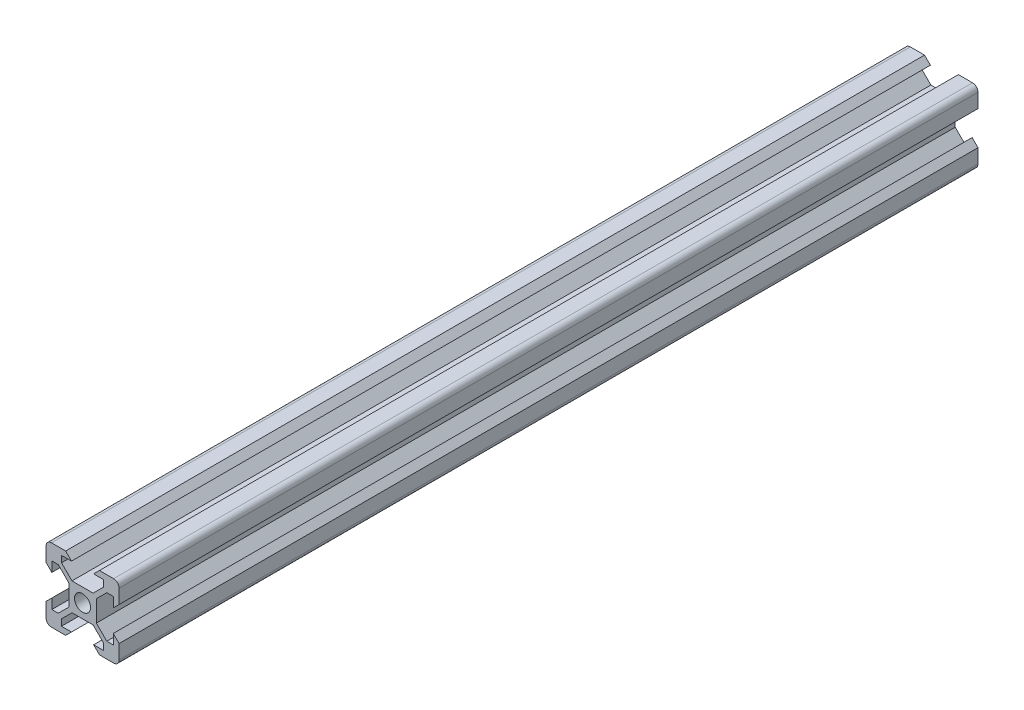
from build123d import *

# Parameters (mm, degrees)
SKETCH1_W           = 15.088
SKETCH1_H           = 15.088
SKETCH1_R           = 4.4
BOSS_EXTRUDE1_DEPTH = 235


with BuildPart() as part:
    # Sketch1 → Boss-Extrude1 (new, symmetric)
    # profile 1 of 5: a face of its own
    with BuildSketch(Plane.XY):
        with BuildLine():
            Line((-7.544, 7.544), (-5.784718328, 7.544))
            Line((-5.784718328, 7.544), (-11.512, 13.271281672))
            Line((-11.512, 13.271281672), (-11.512, 16.8))
            Line((-11.512, 16.8), (-6.051976926, 16.8))
            Line((-6.051976926, 16.8), (-9.251976926, 20))
            Line((-9.251976926, 20), (-17, 20))
            ThreePointArc((-17, 20), (-19.121320344, 19.121320344), (-20, 17))
            Line((-20, 17), (-20, 9.251976926))
            Line((-20, 9.251976926), (-16.8, 6.051976926))
            Line((-16.8, 6.051976926), (-16.8, 11.512))
            Line((-16.8, 11.512), (-13.271281672, 11.512))
            Line((-13.271281672, 11.512), (-7.544, 5.784718328))
            Line((-7.544, 5.784718328), (-7.544, 7.544))
        make_face()
    # profile 2 of 5: a face of its own
    with BuildSketch(Plane.XY):
        with BuildLine():
            Line((11.512, 13.271281672), (5.784718328, 7.544))
            Line((5.784718328, 7.544), (7.544, 7.544))
            Line((7.544, 7.544), (7.544, 5.784718328))
            Line((7.544, 5.784718328), (13.271281672, 11.512))
            Line((13.271281672, 11.512), (16.8, 11.512))
            Line((16.8, 11.512), (16.8, 6.051976926))
            Line((16.8, 6.051976926), (20, 9.251976926))
            Line((20, 9.251976926), (20, 17))
            ThreePointArc((20, 17), (19.121320344, 19.121320344), (17, 20))
            Line((17, 20), (9.251976926, 20))
            Line((9.251976926, 20), (6.051976926, 16.8))
            Line((6.051976926, 16.8), (11.512, 16.8))
            Line((11.512, 16.8), (11.512, 13.271281672))
        make_face()
    # profile 3 of 5: a face of its own
    with BuildSketch(Plane.XY):
        with BuildLine():
            Line((-7.544, -7.544), (-7.544, -5.784718328))
            Line((-7.544, -5.784718328), (-13.271281672, -11.512))
            Line((-13.271281672, -11.512), (-16.8, -11.512))
            Line((-16.8, -11.512), (-16.8, -6.051976926))
            Line((-16.8, -6.051976926), (-20, -9.251976926))
            Line((-20, -9.251976926), (-20, -17))
            ThreePointArc((-20, -17), (-19.121320344, -19.121320344), (-17, -20))
            Line((-17, -20), (-9.251976926, -20))
            Line((-9.251976926, -20), (-6.051976926, -16.8))
            Line((-6.051976926, -16.8), (-11.512, -16.8))
            Line((-11.512, -16.8), (-11.512, -13.271281672))
            Line((-11.512, -13.271281672), (-5.784718328, -7.544))
            Line((-5.784718328, -7.544), (-7.544, -7.544))
        make_face()
    # profile 4 of 5: a face of its own
    with BuildSketch(Plane.XY):
        with BuildLine():
            Line((13.271281672, -11.512), (7.544, -5.784718328))
            Line((7.544, -5.784718328), (7.544, -7.544))
            Line((7.544, -7.544), (5.784718328, -7.544))
            Line((5.784718328, -7.544), (11.512, -13.271281672))
            Line((11.512, -13.271281672), (11.512, -16.8))
            Line((11.512, -16.8), (6.051976926, -16.8))
            Line((6.051976926, -16.8), (9.251976926, -20))
            Line((9.251976926, -20), (17, -20))
            ThreePointArc((17, -20), (19.121320344, -19.121320344), (20, -17))
            Line((20, -17), (20, -9.251976926))
            Line((20, -9.251976926), (16.8, -6.051976926))
            Line((16.8, -6.051976926), (16.8, -11.512))
            Line((16.8, -11.512), (13.271281672, -11.512))
        make_face()
    # profile 5 of 5: a face of its own
    with BuildSketch(Plane.XY):
        Rectangle(SKETCH1_W, SKETCH1_H)
        with Locations(Location((0, 0, 0), (0, 0, 180))):
            Circle(SKETCH1_R, mode=Mode.SUBTRACT)
    extrude(amount=BOSS_EXTRUDE1_DEPTH, both=True)


solid = part.part
